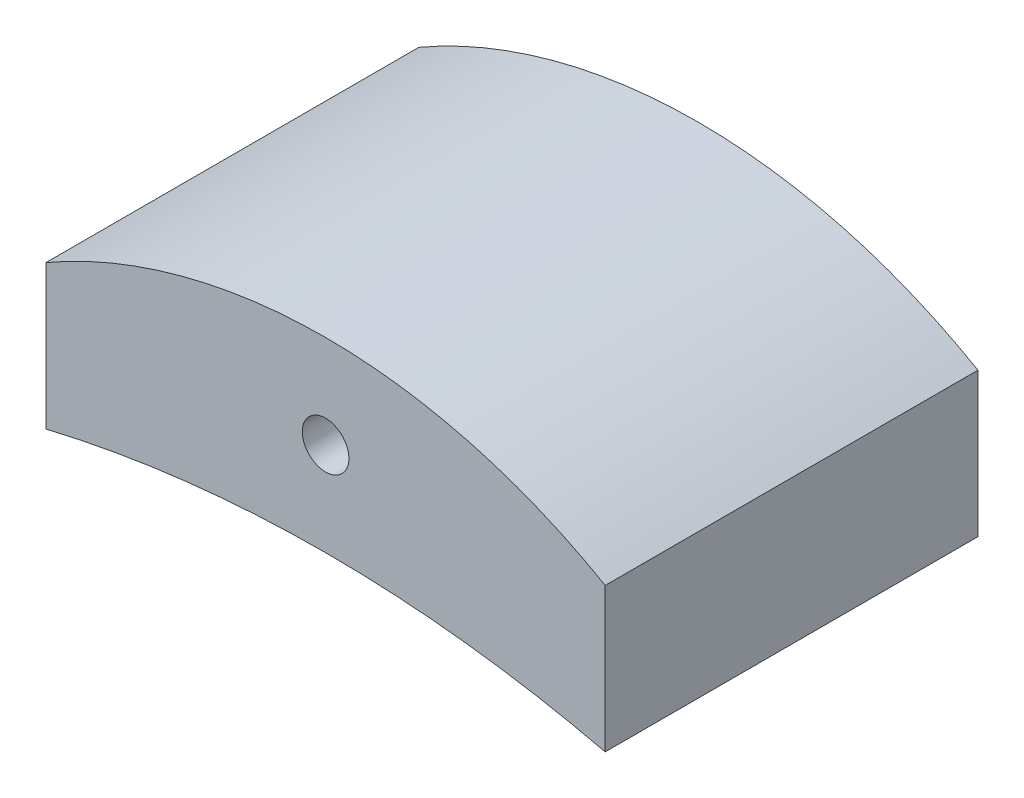
from build123d import *

# Parameters (mm, degrees)
SKETCH1_R           = 3.175
BOSS_EXTRUDE2_DEPTH = 50.8
SKETCH3_R           = 4.7625
CUT_EXTRUDE2_DEPTH  = 38.1


with BuildPart() as part:
    # Sketch1 → Boss-Extrude2 (new body)
    with BuildSketch(Plane.XY):
        with BuildLine():
            Line((0, 65.991135768), (0, 46.343705137))
            ThreePointArc((0, 46.343705137), (38.1, 50.8), (76.2, 46.343705137))
            Line((76.2, 46.343705137), (76.2, 65.991135768))
            ThreePointArc((76.2, 65.991135768), (38.1, 76.2), (0, 65.991135768))
        make_face()
        with Locations((38.1, 63.5)):
            Circle(SKETCH1_R, mode=Mode.SUBTRACT)
    extrude(amount=BOSS_EXTRUDE2_DEPTH)

    # Sketch3 → Cut-Extrude2 (cut)
    with BuildSketch(Plane(origin=(0, 0, 0), x_dir=(-1, 0, 0), z_dir=(0, 0, -1))):
        with Locations((-38.1, 63.5)):
            Circle(SKETCH3_R)
    extrude(amount=-CUT_EXTRUDE2_DEPTH, mode=Mode.SUBTRACT)


solid = part.part
